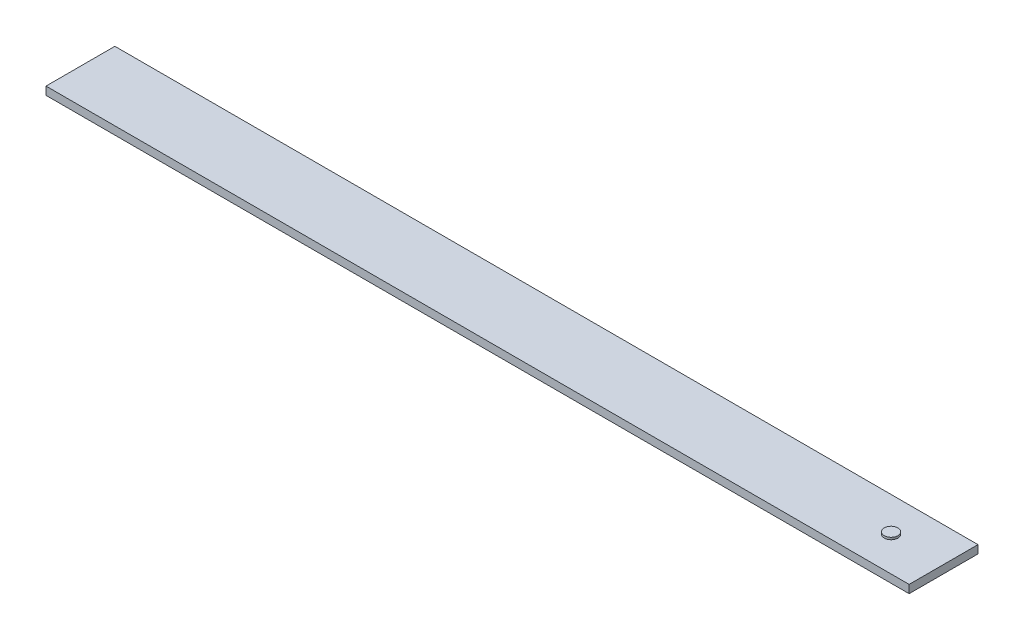
from build123d import *

# Parameters (mm, degrees)
ESBO_O1_W                = 401
ESBO_O1_H                = 32
RESSALTO_EXTRUS_O1_DEPTH = 3.75
ESBO_O6_R                = 3.15
RESSALTO_EXTRUS_O3_DEPTH = 1


with BuildPart() as part:
    # Esboço1 → Ressalto-extrusão1 (new body)
    with BuildSketch(Plane(origin=(0, 0, 0), x_dir=(1, 0, 0), z_dir=(0, 1, 0))):
        with Locations((200.5, 16)):
            Rectangle(ESBO_O1_W, ESBO_O1_H)
    extrude(amount=RESSALTO_EXTRUS_O1_DEPTH)

    # Esboço6 → Ressalto-extrusão3 (add)
    with BuildSketch(Plane(origin=(0, 3.75, 0), x_dir=(1, 0, 0), z_dir=(0, 1, 0))):
        with Locations(Location((376.65, 16, 0), (0, 0, 90))):
            Circle(ESBO_O6_R)
    extrude(amount=RESSALTO_EXTRUS_O3_DEPTH)


solid = part.part
